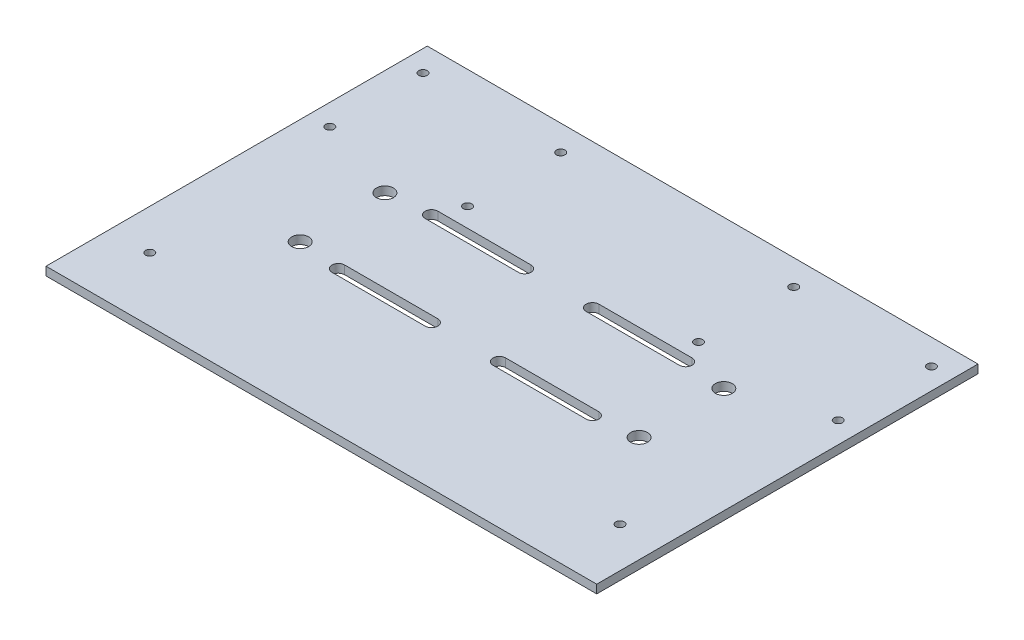
from build123d import *

# Parameters (mm, degrees)
SKETCH1_W           = 130
SKETCH1_H           = 90
BOSS_EXTRUDE2_DEPTH = 2
SKETCH2_R           = 2
CUT_EXTRUDE1_DEPTH  = 10
CUT_EXTRUDE3_DEPTH  = 10
SKETCH5_R           = 1
CUT_EXTRUDE4_DEPTH  = 10


with BuildPart() as part:
    # Sketch1 → Boss-Extrude2 (new body)
    with BuildSketch(Plane(origin=(0, 0, 0), x_dir=(1, 0, 0), z_dir=(0, 1, 0))):
        with Locations((56.787418592, 40.403463793)):
            Rectangle(SKETCH1_W, SKETCH1_H)
    extrude(amount=BOSS_EXTRUDE2_DEPTH)

    # Sketch2 → Cut-Extrude1 (cut)
    with BuildSketch(Plane(origin=(0, 2, 0), x_dir=(1, 0, 0), z_dir=(0, 1, 0))):
        with Locations(Location((16.787418592, 50.403463793, 0), (0, 0, 270))):
            Circle(SKETCH2_R)
        with Locations(Location((16.787418592, 30.403463793, 0), (0, 0, 270))):
            Circle(SKETCH2_R)
        with Locations(Location((96.787418592, 50.403463793, 0), (0, 0, 270))):
            Circle(SKETCH2_R)
        with Locations(Location((96.787418592, 30.403463793, 0), (0, 0, 270))):
            Circle(SKETCH2_R)
    extrude(amount=-CUT_EXTRUDE1_DEPTH, mode=Mode.SUBTRACT)

    # Sketch4 → Cut-Extrude3 (cut)
    with BuildSketch(Plane(origin=(0, 2, 0), x_dir=(1, 0, 0), z_dir=(0, 1, 0))):
        with BuildLine():
            Line((26.787418592, 52.903463793), (48.787418592, 52.903463793))
            ThreePointArc((48.787418592, 52.903463793), (50.287418592, 51.403463793), (48.787418592, 49.903463793))
            Line((48.787418592, 49.903463793), (26.787418592, 49.903463793))
            ThreePointArc((26.787418592, 49.903463793), (25.287418592, 51.403463793), (26.787418592, 52.903463793))
        make_face()
        with BuildLine():
            Line((26.787418592, 30.903463793), (48.787418592, 30.903463793))
            ThreePointArc((48.787418592, 30.903463793), (50.287418592, 29.403463793), (48.787418592, 27.903463793))
            Line((48.787418592, 27.903463793), (26.787418592, 27.903463793))
            ThreePointArc((26.787418592, 27.903463793), (25.287418592, 29.403463793), (26.787418592, 30.903463793))
        make_face()
        with BuildLine():
            Line((64.787418592, 52.903463793), (86.787418592, 52.903463793))
            ThreePointArc((86.787418592, 52.903463793), (88.287418592, 51.403463793), (86.787418592, 49.903463793))
            Line((86.787418592, 49.903463793), (64.787418592, 49.903463793))
            ThreePointArc((64.787418592, 49.903463793), (63.287418592, 51.403463793), (64.787418592, 52.903463793))
        make_face()
        with BuildLine():
            Line((64.787418592, 30.903463793), (86.787418592, 30.903463793))
            ThreePointArc((86.787418592, 30.903463793), (88.287418592, 29.403463793), (86.787418592, 27.903463793))
            Line((86.787418592, 27.903463793), (64.787418592, 27.903463793))
            ThreePointArc((64.787418592, 27.903463793), (63.287418592, 29.403463793), (64.787418592, 30.903463793))
        make_face()
    extrude(amount=-CUT_EXTRUDE3_DEPTH, mode=Mode.SUBTRACT)

    # Sketch5 → Cut-Extrude4 (cut)
    with BuildSketch(Plane(origin=(0, 2, 0), x_dir=(1, 0, 0), z_dir=(0, 1, 0))):
        with Locations(Location((1.287418592, 10.403463793, 0), (0, 0, 270))):
            Circle(SKETCH5_R)
        with Locations(Location((112.287418592, 10.403463793, 0), (0, 0, 270))):
            Circle(SKETCH5_R)
        with Locations(Location((84.287418592, 56.920801797, 0), (0, 0, 270))):
            Circle(SKETCH5_R)
        with Locations(Location((116.787418592, 57.403463793, 0), (0, 0, 270))):
            Circle(SKETCH5_R)
        with Locations(Location((116.787418592, 79.403463793, 0), (0, 0, 270))):
            Circle(SKETCH5_R)
        with Locations(Location((84.287418592, 79.403463793, 0), (0, 0, 270))):
            Circle(SKETCH5_R)
        with Locations(Location((-3.212581408, 57.403463793, 0), (0, 0, 270))):
            Circle(SKETCH5_R)
        with Locations(Location((29.287418592, 57.403463793, 0), (0, 0, 270))):
            Circle(SKETCH5_R)
        with Locations(Location((29.287418592, 79.403463793, 0), (0, 0, 270))):
            Circle(SKETCH5_R)
        with Locations(Location((-3.212581408, 79.403463793, 0), (0, 0, 270))):
            Circle(SKETCH5_R)
    extrude(amount=-CUT_EXTRUDE4_DEPTH, mode=Mode.SUBTRACT)


solid = part.part
